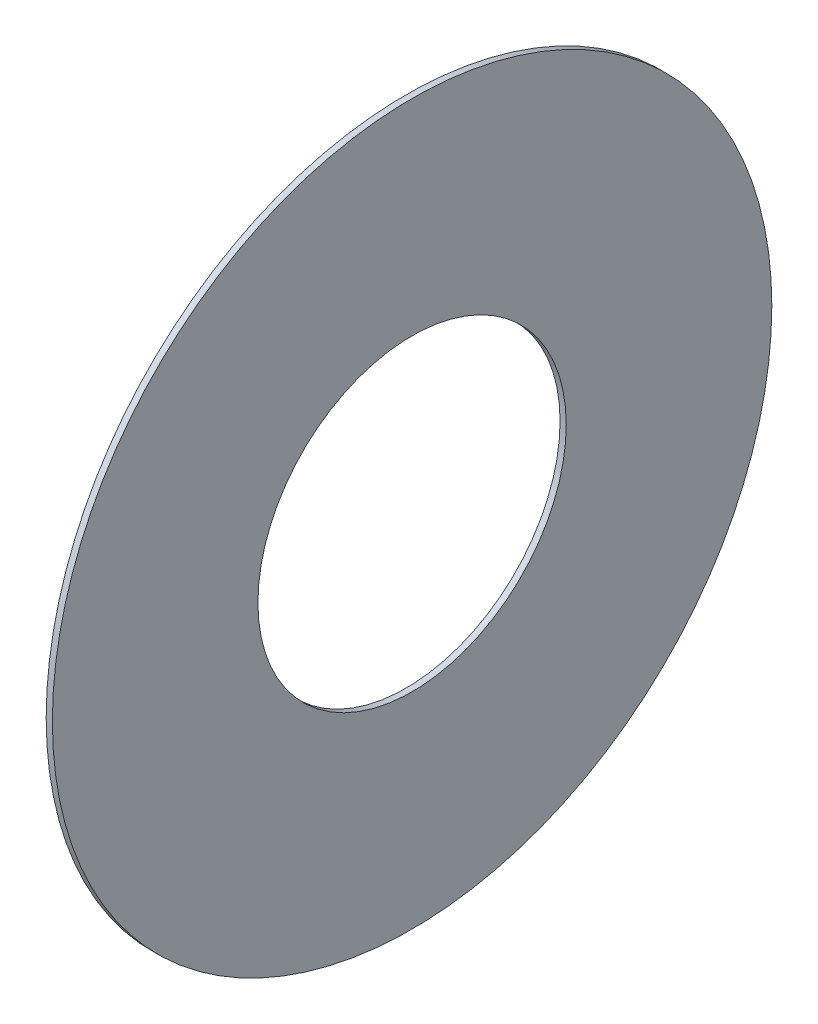
from build123d import *

# Parameters (mm, degrees)
SKETCH1_R           = 48.895
SKETCH1_R_2         = 20.955
BOSS_EXTRUDE1_DEPTH = 0.8382


with BuildPart() as part:
    # Sketch1 → Boss-Extrude1 (new body)
    with BuildSketch(Plane(origin=(0, 0, 0), x_dir=(0, 0, -1), z_dir=(1, 0, 0))):
        Circle(SKETCH1_R)
        Circle(SKETCH1_R_2, mode=Mode.SUBTRACT)
    extrude(amount=BOSS_EXTRUDE1_DEPTH)


solid = part.part
